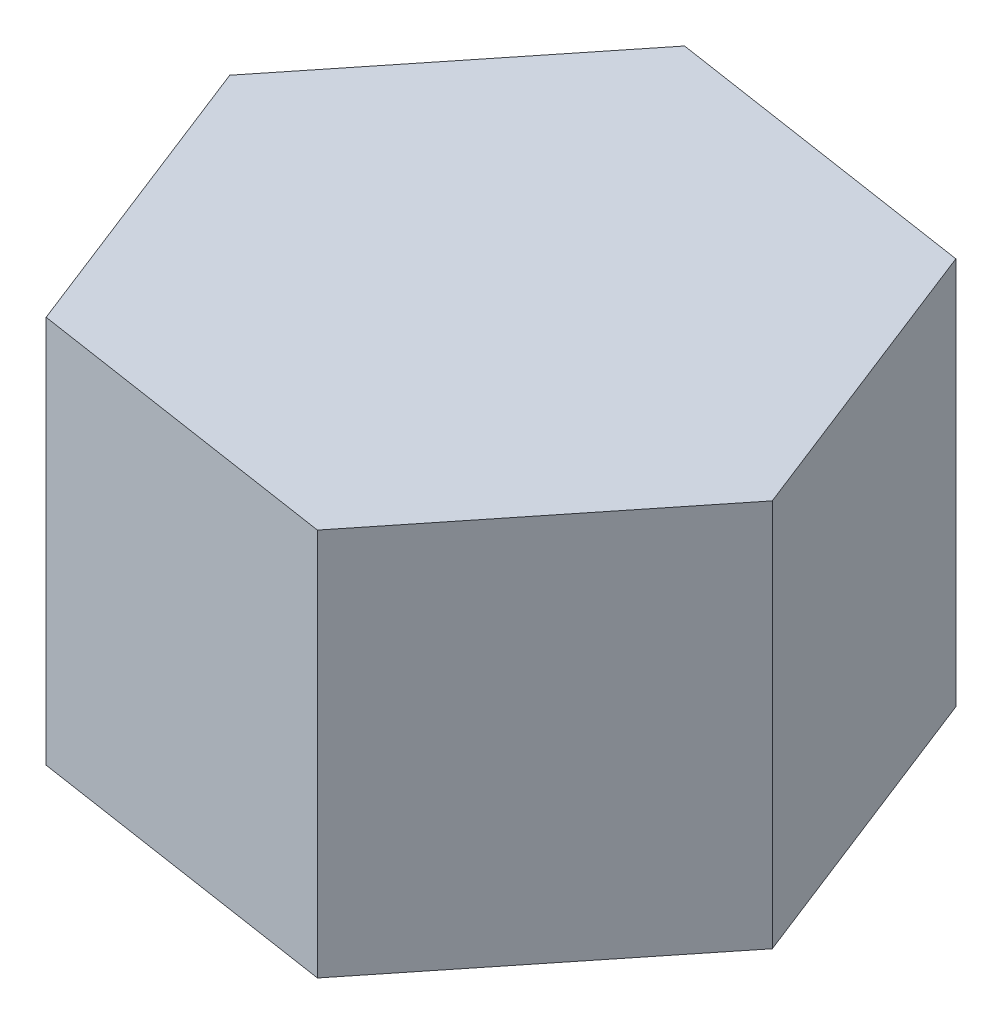
from build123d import *

# Parameters (mm, degrees)
EXTRUDE_1_DEPTH     = 7
SKETCH_2_W          = 8.4
SKETCH_2_H          = 2.4
CUT_EXTRUDE_1_DEPTH = 5


with BuildPart() as part:
    # 草图1 → 凸台-拉伸1 (new body)
    with BuildSketch(Plane(origin=(0, 0, 0), x_dir=(1, 0, 0), z_dir=(0, 1, 0))):
        Polygon((3.647320061, 4.560885447), (-2.12618263, 5.439114553), (-5.773502692, 0.878229105), (-3.647320061, -4.560885447), (2.12618263, -5.439114553), (5.773502692, -0.878229105), align=None)
    extrude(amount=EXTRUDE_1_DEPTH)

    # 草图2 → 切除-拉伸1 (cut)
    with BuildSketch(Plane(origin=(0, 0, 0), x_dir=(-1, 0, 0), z_dir=(0, -1, 0))):
        with Locations((0, 0.1)):
            Rectangle(SKETCH_2_W, SKETCH_2_H)
    extrude(amount=-CUT_EXTRUDE_1_DEPTH, mode=Mode.SUBTRACT)


solid = part.part
